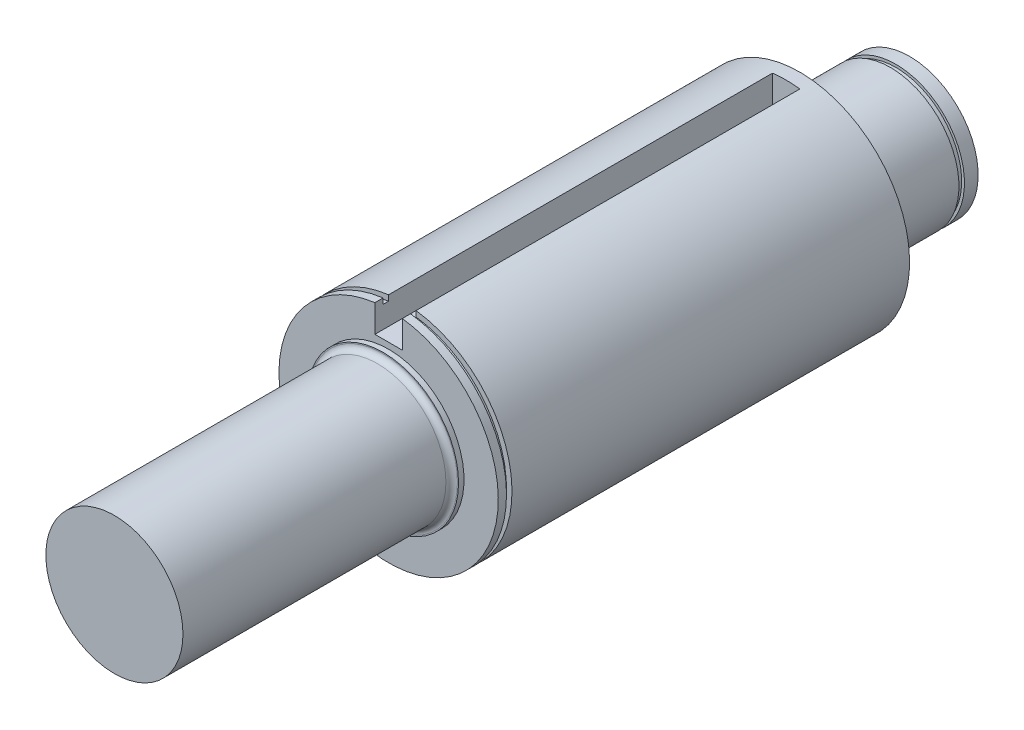
from build123d import *

# Parameters (mm, degrees)
ESQUISSE1_R             = 25
BOSS_EXTRU_1_DEPTH      = 100
BOSS_EXTRU_3_DEPTH      = 150
ESQUISSE5_R             = 25
BOSS_EXTRU_4_DEPTH      = 40
ESQUISSE6_R             = 27.5
BOSS_EXTRU_5_DEPTH      = 2
CONG_2_R                = 2.1
CONG_3_R                = 2.1
ESQUISSE7_R             = 25
ESQUISSE7_R_2           = 24
ENL_V_MAT_EXTRU_1_DEPTH = 2
BOSS_EXTRU_6_START      = -5
BOSS_EXTRU_6_DEPTH      = 5
ENL_V_START             = 2
ESQUISSE10_R            = 40
ESQUISSE10_R_2          = 38
ENL_V_MAT_EXTRU_2_DEPTH = 2


with BuildPart() as part:
    # Esquisse1 → Boss.-Extru.1 (new body)
    with BuildSketch(Plane.XY):
        Circle(ESQUISSE1_R)
    extrude(amount=-BOSS_EXTRU_1_DEPTH)

    # Esquisse4 → Boss.-Extru.3 (add)
    with BuildSketch(Plane(origin=(0, 0, -100), x_dir=(-1, 0, 0), z_dir=(0, 0, -1))):
        with BuildLine():
            Line((-5, 39.686269666), (-5, 29.686269666))
            Line((-5, 29.686269666), (5, 29.686269666))
            Line((5, 29.686269666), (5, 39.686269666))
            ThreePointArc((5, 39.686269666), (0, -40), (-5, 39.686269666))
        make_face()
    extrude(amount=BOSS_EXTRU_3_DEPTH)

    # Esquisse5 → Boss.-Extru.4 (add)
    with BuildSketch(Plane(origin=(0, 0, -250), x_dir=(-1, 0, 0), z_dir=(0, 0, -1))):
        with Locations(Location((0, 0, 0), (0, 0, 180))):
            Circle(ESQUISSE5_R)
    extrude(amount=BOSS_EXTRU_4_DEPTH)

    # Esquisse6 → Boss.-Extru.5 (add)
    with BuildSketch(Plane.XY.offset(-100)):
        with Locations(Location((0, 0, 0), (0, 0, 180))):
            Circle(ESQUISSE6_R)
    boss_extru_5 = extrude(amount=BOSS_EXTRU_5_DEPTH)

    # Congé2
    cong_2_edges = [part.edges().sort_by_distance(p)[0] for p in [
        (-25, 0, -98),
    ]]
    fillet(cong_2_edges, radius=CONG_2_R)

    # Symétrie3: Boss.-Extru.5 across plane
    add(boss_extru_5.mirror(Plane.XY.offset(-175)))

    # Congé3
    cong_3_edges = [part.edges().sort_by_distance(p)[0] for p in [
        (-25, 0, -252),
    ]]
    fillet(cong_3_edges, radius=CONG_3_R)

    # Esquisse7 → Enlèv. mat.-Extru.1 (cut)
    with BuildSketch(Plane(origin=(0, 0, -283), x_dir=(-1, 0, 0), z_dir=(0, 0, -1))):
        Circle(ESQUISSE7_R)
        Circle(ESQUISSE7_R_2, mode=Mode.SUBTRACT)
    extrude(amount=ENL_V_MAT_EXTRU_1_DEPTH, mode=Mode.SUBTRACT)

    # Esquisse9 → Boss.-Extru.6 (add)
    with BuildSketch(Plane(origin=(0, 0, -250), x_dir=(-1, 0, 0), z_dir=(0, 0, -1)).offset(BOSS_EXTRU_6_START)):
        with BuildLine():
            ThreePointArc((-5, 39.686269666), (0, 40), (5, 39.686269666))
            Line((5, 39.686269666), (5, 29.686269666))
            Line((5, 29.686269666), (-5, 29.686269666))
            Line((-5, 29.686269666), (-5, 39.686269666))
        make_face()
    extrude(amount=BOSS_EXTRU_6_DEPTH)

    # Esquisse10 → Enlèv. mat.-Extru.2 (cut)
    with BuildSketch(Plane.XY.offset(-105).offset(ENL_V_START)):
        with Locations(Location((0, 0, 0), (0, 0, 82.819244219))):
            Circle(ESQUISSE10_R)
        Circle(ESQUISSE10_R_2, mode=Mode.SUBTRACT)
    extrude(amount=-ENL_V_MAT_EXTRU_2_DEPTH, mode=Mode.SUBTRACT)


solid = part.part
